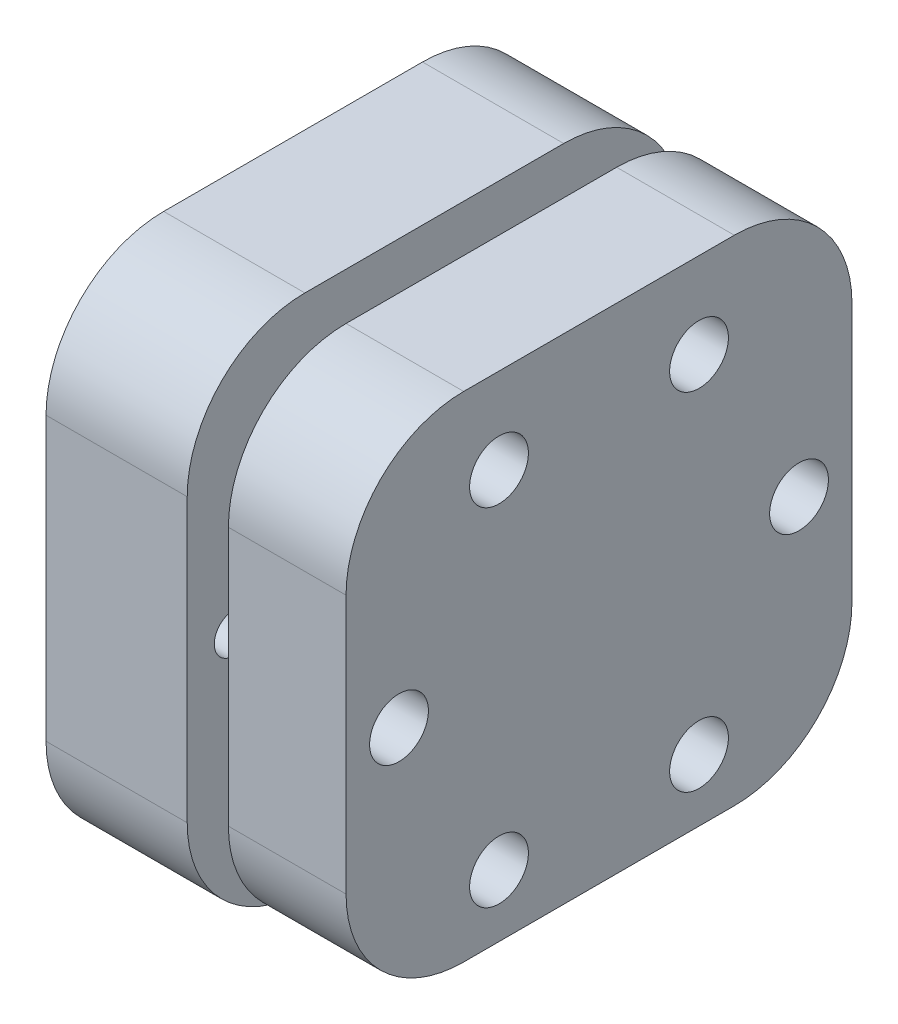
from build123d import *

# Parameters (mm, degrees)
SKETCH2_W           = 10
SKETCH2_H           = 43
BOSS_EXTRUDE1_DEPTH = 42
SKETCH3_W           = 25
SKETCH3_H           = 9
BOSS_EXTRUDE2_DEPTH = 4
SKETCH5_W           = 42
SKETCH5_H           = 44
SKETCH5_R           = 3
BOSS_EXTRUDE3_DEPTH = 12
SKETCH5_3_R         = 3
SKETCH5_3_R_2       = 2.5
SKETCH5_3_R_3       = 1.7
CUT_EXTRUDE1_DEPTH  = 20
BOSS_EXTRUDE4_START = -4
SKETCH5_12_R        = 3
SKETCH5_12_R_2      = 2.5
SKETCH5_12_R_3      = 1.7
BOSS_EXTRUDE4_DEPTH = 6
BOSS_EXTRUDE5_START = -10
SKETCH5_13_R        = 3
SKETCH5_13_R_2      = 2.5
BOSS_EXTRUDE5_DEPTH = 4
BOSS_EXTRUDE6_START = 12
SKETCH5_15_R        = 3
SKETCH5_15_R_2      = 2.5
SKETCH5_15_R_3      = 1.7
BOSS_EXTRUDE6_DEPTH = 12
FILLET1_R           = 10


with BuildPart() as part:
    # Sketch2 → Boss-Extrude1 (new body)
    with BuildSketch(Plane.XZ.offset(-159.674864957)):
        with Locations((-5, 0)):
            Rectangle(SKETCH2_W, SKETCH2_H)
    extrude(amount=BOSS_EXTRUDE1_DEPTH)

    # Sketch3 → Boss-Extrude2 (add)
    with BuildSketch(Plane.ZY.offset(10)):
        with Locations((0, 134.174864957)):
            Rectangle(SKETCH3_W, SKETCH3_H)
    extrude(amount=BOSS_EXTRUDE2_DEPTH)

    # Sketch5<3> → Cut-Extrude1 (cut)
    # profile 1 of 18: a face of its own
    with BuildSketch(Plane.ZY.offset(14)):
        with Locations((-8.5, 152.397296821)):
            Circle(SKETCH5_3_R)
        with Locations((-8.5, 152.397296821)):
            Circle(SKETCH5_3_R_2, mode=Mode.SUBTRACT)
    # profile 2 of 18: a face of its own
    with BuildSketch(Plane.ZY.offset(14)):
        with Locations((-8.5, 152.397296821)):
            Circle(SKETCH5_3_R_2)
        with Locations((-8.5, 152.397296821)):
            Circle(SKETCH5_3_R_3, mode=Mode.SUBTRACT)
    # profile 3 of 18: a face of its own
    with BuildSketch(Plane.ZY.offset(14)):
        with Locations((-8.5, 152.397296821)):
            Circle(SKETCH5_3_R_3)
    # profile 4 of 18: a face of its own
    with BuildSketch(Plane.ZY.offset(14)):
        with Locations((8.5, 152.397296821)):
            Circle(SKETCH5_3_R)
        with Locations((8.5, 152.397296821)):
            Circle(SKETCH5_3_R_2, mode=Mode.SUBTRACT)
    # profile 5 of 18: a face of its own
    with BuildSketch(Plane.ZY.offset(14)):
        with Locations((8.5, 152.397296821)):
            Circle(SKETCH5_3_R_2)
        with Locations((8.5, 152.397296821)):
            Circle(SKETCH5_3_R_3, mode=Mode.SUBTRACT)
    # profile 6 of 18: a face of its own
    with BuildSketch(Plane.ZY.offset(14)):
        with Locations((8.5, 152.397296821)):
            Circle(SKETCH5_3_R_3)
    # profile 7 of 18: a face of its own
    with BuildSketch(Plane.ZY.offset(14)):
        with Locations((17, 137.674864957)):
            Circle(SKETCH5_3_R)
        with Locations((17, 137.674864957)):
            Circle(SKETCH5_3_R_2, mode=Mode.SUBTRACT)
    # profile 8 of 18: a face of its own
    with BuildSketch(Plane.ZY.offset(14)):
        with Locations((17, 137.674864957)):
            Circle(SKETCH5_3_R_2)
        with Locations((17, 137.674864957)):
            Circle(SKETCH5_3_R_3, mode=Mode.SUBTRACT)
    # profile 9 of 18: a face of its own
    with BuildSketch(Plane.ZY.offset(14)):
        with Locations((17, 137.674864957)):
            Circle(SKETCH5_3_R_3)
    # profile 10 of 18: a face of its own
    with BuildSketch(Plane.ZY.offset(14)):
        with Locations((-17, 137.674864957)):
            Circle(SKETCH5_3_R)
        with Locations((-17, 137.674864957)):
            Circle(SKETCH5_3_R_2, mode=Mode.SUBTRACT)
    # profile 11 of 18: a face of its own
    with BuildSketch(Plane.ZY.offset(14)):
        with Locations((-17, 137.674864957)):
            Circle(SKETCH5_3_R_2)
        with Locations((-17, 137.674864957)):
            Circle(SKETCH5_3_R_3, mode=Mode.SUBTRACT)
    # profile 12 of 18: a face of its own
    with BuildSketch(Plane.ZY.offset(14)):
        with Locations((-17, 137.674864957)):
            Circle(SKETCH5_3_R_3)
    # profile 13 of 18: a face of its own
    with BuildSketch(Plane.ZY.offset(14)):
        with Locations((-8.5, 122.952433093)):
            Circle(SKETCH5_3_R)
        with Locations((-8.5, 122.952433093)):
            Circle(SKETCH5_3_R_2, mode=Mode.SUBTRACT)
    # profile 14 of 18: a face of its own
    with BuildSketch(Plane.ZY.offset(14)):
        with Locations((-8.5, 122.952433093)):
            Circle(SKETCH5_3_R_2)
        with Locations((-8.5, 122.952433093)):
            Circle(SKETCH5_3_R_3, mode=Mode.SUBTRACT)
    # profile 15 of 18: a face of its own
    with BuildSketch(Plane.ZY.offset(14)):
        with Locations((-8.5, 122.952433093)):
            Circle(SKETCH5_3_R_3)
    # profile 16 of 18: a face of its own
    with BuildSketch(Plane.ZY.offset(14)):
        with Locations((8.5, 122.952433093)):
            Circle(SKETCH5_3_R)
        with Locations((8.5, 122.952433093)):
            Circle(SKETCH5_3_R_2, mode=Mode.SUBTRACT)
    # profile 17 of 18: a face of its own
    with BuildSketch(Plane.ZY.offset(14)):
        with Locations((8.5, 122.952433093)):
            Circle(SKETCH5_3_R_2)
        with Locations((8.5, 122.952433093)):
            Circle(SKETCH5_3_R_3, mode=Mode.SUBTRACT)
    # profile 18 of 18: a face of its own
    with BuildSketch(Plane.ZY.offset(14)):
        with Locations((8.5, 122.952433093)):
            Circle(SKETCH5_3_R_3)
    extrude(amount=-CUT_EXTRUDE1_DEPTH, mode=Mode.SUBTRACT)

    # Sketch5<12> → Boss-Extrude4 (add)
    # profile 1 of 12: a face of its own
    with BuildSketch(Plane.ZY.offset(14).offset(BOSS_EXTRUDE4_START)):
        with Locations((8.5, 152.397296821)):
            Circle(SKETCH5_12_R)
        with Locations((8.5, 152.397296821)):
            Circle(SKETCH5_12_R_2, mode=Mode.SUBTRACT)
    # profile 2 of 12: a face of its own
    with BuildSketch(Plane.ZY.offset(14).offset(BOSS_EXTRUDE4_START)):
        with Locations((-8.5, 152.397296821)):
            Circle(SKETCH5_12_R)
        with Locations((-8.5, 152.397296821)):
            Circle(SKETCH5_12_R_2, mode=Mode.SUBTRACT)
    # profile 3 of 12: a face of its own
    with BuildSketch(Plane.ZY.offset(14).offset(BOSS_EXTRUDE4_START)):
        with Locations((17, 137.674864957)):
            Circle(SKETCH5_12_R)
        with Locations((17, 137.674864957)):
            Circle(SKETCH5_12_R_2, mode=Mode.SUBTRACT)
    # profile 4 of 12: a face of its own
    with BuildSketch(Plane.ZY.offset(14).offset(BOSS_EXTRUDE4_START)):
        with Locations((8.5, 122.952433093)):
            Circle(SKETCH5_12_R)
        with Locations((8.5, 122.952433093)):
            Circle(SKETCH5_12_R_2, mode=Mode.SUBTRACT)
    # profile 5 of 12: a face of its own
    with BuildSketch(Plane.ZY.offset(14).offset(BOSS_EXTRUDE4_START)):
        with Locations((-8.5, 122.952433093)):
            Circle(SKETCH5_12_R)
        with Locations((-8.5, 122.952433093)):
            Circle(SKETCH5_12_R_2, mode=Mode.SUBTRACT)
    # profile 6 of 12: a face of its own
    with BuildSketch(Plane.ZY.offset(14).offset(BOSS_EXTRUDE4_START)):
        with Locations((-17, 137.674864957)):
            Circle(SKETCH5_12_R)
        with Locations((-17, 137.674864957)):
            Circle(SKETCH5_12_R_2, mode=Mode.SUBTRACT)
    # profile 7 of 12: a face of its own
    with BuildSketch(Plane.ZY.offset(14).offset(BOSS_EXTRUDE4_START)):
        with Locations((8.5, 152.397296821)):
            Circle(SKETCH5_12_R_2)
        with Locations((8.5, 152.397296821)):
            Circle(SKETCH5_12_R_3, mode=Mode.SUBTRACT)
    # profile 8 of 12: a face of its own
    with BuildSketch(Plane.ZY.offset(14).offset(BOSS_EXTRUDE4_START)):
        with Locations((17, 137.674864957)):
            Circle(SKETCH5_12_R_2)
        with Locations((17, 137.674864957)):
            Circle(SKETCH5_12_R_3, mode=Mode.SUBTRACT)
    # profile 9 of 12: a face of its own
    with BuildSketch(Plane.ZY.offset(14).offset(BOSS_EXTRUDE4_START)):
        with Locations((8.5, 122.952433093)):
            Circle(SKETCH5_12_R_2)
        with Locations((8.5, 122.952433093)):
            Circle(SKETCH5_12_R_3, mode=Mode.SUBTRACT)
    # profile 10 of 12: a face of its own
    with BuildSketch(Plane.ZY.offset(14).offset(BOSS_EXTRUDE4_START)):
        with Locations((-8.5, 122.952433093)):
            Circle(SKETCH5_12_R_2)
        with Locations((-8.5, 122.952433093)):
            Circle(SKETCH5_12_R_3, mode=Mode.SUBTRACT)
    # profile 11 of 12: a face of its own
    with BuildSketch(Plane.ZY.offset(14).offset(BOSS_EXTRUDE4_START)):
        with Locations((-17, 137.674864957)):
            Circle(SKETCH5_12_R_2)
        with Locations((-17, 137.674864957)):
            Circle(SKETCH5_12_R_3, mode=Mode.SUBTRACT)
    # profile 12 of 12: a face of its own
    with BuildSketch(Plane.ZY.offset(14).offset(BOSS_EXTRUDE4_START)):
        with Locations((-8.5, 152.397296821)):
            Circle(SKETCH5_12_R_2)
        with Locations((-8.5, 152.397296821)):
            Circle(SKETCH5_12_R_3, mode=Mode.SUBTRACT)
    extrude(amount=-BOSS_EXTRUDE4_DEPTH)

    # Sketch5<13> → Boss-Extrude5 (add)
    # profile 1 of 6: a face of its own
    with BuildSketch(Plane.ZY.offset(14).offset(BOSS_EXTRUDE5_START)):
        with Locations((8.5, 152.397296821)):
            Circle(SKETCH5_13_R)
        with Locations((8.5, 152.397296821)):
            Circle(SKETCH5_13_R_2, mode=Mode.SUBTRACT)
    # profile 2 of 6: a face of its own
    with BuildSketch(Plane.ZY.offset(14).offset(BOSS_EXTRUDE5_START)):
        with Locations((-8.5, 152.397296821)):
            Circle(SKETCH5_13_R)
        with Locations((-8.5, 152.397296821)):
            Circle(SKETCH5_13_R_2, mode=Mode.SUBTRACT)
    # profile 3 of 6: a face of its own
    with BuildSketch(Plane.ZY.offset(14).offset(BOSS_EXTRUDE5_START)):
        with Locations((-17, 137.674864957)):
            Circle(SKETCH5_13_R)
        with Locations((-17, 137.674864957)):
            Circle(SKETCH5_13_R_2, mode=Mode.SUBTRACT)
    # profile 4 of 6: a face of its own
    with BuildSketch(Plane.ZY.offset(14).offset(BOSS_EXTRUDE5_START)):
        with Locations((-8.5, 122.952433093)):
            Circle(SKETCH5_13_R)
        with Locations((-8.5, 122.952433093)):
            Circle(SKETCH5_13_R_2, mode=Mode.SUBTRACT)
    # profile 5 of 6: a face of its own
    with BuildSketch(Plane.ZY.offset(14).offset(BOSS_EXTRUDE5_START)):
        with Locations((8.5, 122.952433093)):
            Circle(SKETCH5_13_R)
        with Locations((8.5, 122.952433093)):
            Circle(SKETCH5_13_R_2, mode=Mode.SUBTRACT)
    # profile 6 of 6: a face of its own
    with BuildSketch(Plane.ZY.offset(14).offset(BOSS_EXTRUDE5_START)):
        with Locations((17, 137.674864957)):
            Circle(SKETCH5_13_R)
        with Locations((17, 137.674864957)):
            Circle(SKETCH5_13_R_2, mode=Mode.SUBTRACT)
    extrude(amount=-BOSS_EXTRUDE5_DEPTH)


with BuildPart() as body_2:
    # Sketch5 → Boss-Extrude3 (new body)
    with BuildSketch(Plane.ZY.offset(14)):
        with Locations((0, 137.674864957)):
            Rectangle(SKETCH5_W, SKETCH5_H)
        with Locations((17, 137.674864957)):
            Circle(SKETCH5_R, mode=Mode.SUBTRACT)
        with Locations((8.5, 122.952433093)):
            Circle(SKETCH5_R, mode=Mode.SUBTRACT)
        with Locations((-8.5, 122.952433093)):
            Circle(SKETCH5_R, mode=Mode.SUBTRACT)
        with Locations((-17, 137.674864957)):
            Circle(SKETCH5_R, mode=Mode.SUBTRACT)
        with Locations((-8.5, 152.397296821)):
            Circle(SKETCH5_R, mode=Mode.SUBTRACT)
        with Locations((8.5, 152.397296821)):
            Circle(SKETCH5_R, mode=Mode.SUBTRACT)
    extrude(amount=BOSS_EXTRUDE3_DEPTH)


    add(part.part)  # Boss-Extrude6 merges part
    # Sketch5<15> → Boss-Extrude6 (add)
    # profile 1 of 12: a face of its own
    with BuildSketch(Plane.ZY.offset(14).offset(BOSS_EXTRUDE6_START)):
        with Locations((-8.5, 152.397296821)):
            Circle(SKETCH5_15_R)
        with Locations((-8.5, 152.397296821)):
            Circle(SKETCH5_15_R_2, mode=Mode.SUBTRACT)
    # profile 2 of 12: a face of its own
    with BuildSketch(Plane.ZY.offset(14).offset(BOSS_EXTRUDE6_START)):
        with Locations((-8.5, 152.397296821)):
            Circle(SKETCH5_15_R_2)
        with Locations(Location((-8.5, 152.397296821, 0), (0, 0, 180))):
            Circle(SKETCH5_15_R_3, mode=Mode.SUBTRACT)
    # profile 3 of 12: a face of its own
    with BuildSketch(Plane.ZY.offset(14).offset(BOSS_EXTRUDE6_START)):
        with Locations((-17, 137.674864957)):
            Circle(SKETCH5_15_R)
        with Locations((-17, 137.674864957)):
            Circle(SKETCH5_15_R_2, mode=Mode.SUBTRACT)
    # profile 4 of 12: a face of its own
    with BuildSketch(Plane.ZY.offset(14).offset(BOSS_EXTRUDE6_START)):
        with Locations((-17, 137.674864957)):
            Circle(SKETCH5_15_R_2)
        with Locations((-17, 137.674864957)):
            Circle(SKETCH5_15_R_3, mode=Mode.SUBTRACT)
    # profile 5 of 12: a face of its own
    with BuildSketch(Plane.ZY.offset(14).offset(BOSS_EXTRUDE6_START)):
        with Locations((-8.5, 122.952433093)):
            Circle(SKETCH5_15_R)
        with Locations((-8.5, 122.952433093)):
            Circle(SKETCH5_15_R_2, mode=Mode.SUBTRACT)
    # profile 6 of 12: a face of its own
    with BuildSketch(Plane.ZY.offset(14).offset(BOSS_EXTRUDE6_START)):
        with Locations((-8.5, 122.952433093)):
            Circle(SKETCH5_15_R_2)
        with Locations((-8.5, 122.952433093)):
            Circle(SKETCH5_15_R_3, mode=Mode.SUBTRACT)
    # profile 7 of 12: a face of its own
    with BuildSketch(Plane.ZY.offset(14).offset(BOSS_EXTRUDE6_START)):
        with Locations((8.5, 122.952433093)):
            Circle(SKETCH5_15_R)
        with Locations((8.5, 122.952433093)):
            Circle(SKETCH5_15_R_2, mode=Mode.SUBTRACT)
    # profile 8 of 12: a face of its own
    with BuildSketch(Plane.ZY.offset(14).offset(BOSS_EXTRUDE6_START)):
        with Locations((8.5, 122.952433093)):
            Circle(SKETCH5_15_R_2)
        with Locations((8.5, 122.952433093)):
            Circle(SKETCH5_15_R_3, mode=Mode.SUBTRACT)
    # profile 9 of 12: a face of its own
    with BuildSketch(Plane.ZY.offset(14).offset(BOSS_EXTRUDE6_START)):
        with Locations((8.5, 152.397296821)):
            Circle(SKETCH5_15_R)
        with Locations((8.5, 152.397296821)):
            Circle(SKETCH5_15_R_2, mode=Mode.SUBTRACT)
    # profile 10 of 12: a face of its own
    with BuildSketch(Plane.ZY.offset(14).offset(BOSS_EXTRUDE6_START)):
        with Locations((8.5, 152.397296821)):
            Circle(SKETCH5_15_R_2)
        with Locations((8.5, 152.397296821)):
            Circle(SKETCH5_15_R_3, mode=Mode.SUBTRACT)
    # profile 11 of 12: a face of its own
    with BuildSketch(Plane.ZY.offset(14).offset(BOSS_EXTRUDE6_START)):
        with Locations((17, 137.674864957)):
            Circle(SKETCH5_15_R)
        with Locations((17, 137.674864957)):
            Circle(SKETCH5_15_R_2, mode=Mode.SUBTRACT)
    # profile 12 of 12: a face of its own
    with BuildSketch(Plane.ZY.offset(14).offset(BOSS_EXTRUDE6_START)):
        with Locations((17, 137.674864957)):
            Circle(SKETCH5_15_R_2)
        with Locations((17, 137.674864957)):
            Circle(SKETCH5_15_R_3, mode=Mode.SUBTRACT)
    extrude(amount=-BOSS_EXTRUDE6_DEPTH)

    # Fillet1
    fillet1_edges = [body_2.edges().sort_by_distance(p)[0] for p in [
        (-20, 159.674864957, 21),
        (-20, 115.674864957, 21),
        (-20, 115.674864957, -21),
        (-20, 159.674864957, -21),
        (-5, 159.674864957, 21.5),
        (-5, 159.674864957, -21.5),
        (-5, 117.674864957, 21.5),
        (-5, 117.674864957, -21.5),
    ]]
    fillet(fillet1_edges, radius=FILLET1_R)


solid = body_2.part
